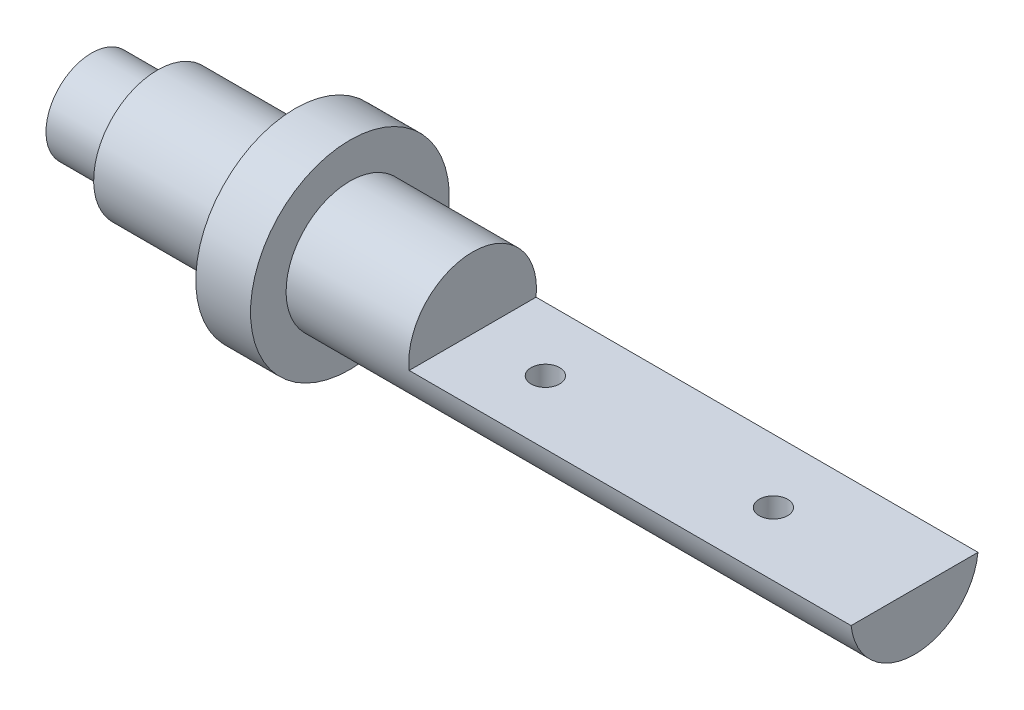
from build123d import *

# Parameters (mm, degrees)
CUT_EXTRUDE1_DEPTH      = 367.129389697
CUT_EXTRUDE1_DEPTH_BACK = 367.129389697
SKETCH2_W               = 193.8
SKETCH2_H               = 31.1
HOLE1_D                 = 12.5


with BuildPart() as part:
    # Sketch1 → Revolve1 (revolve)
    with BuildSketch(Plane.XY):
        Polygon((0, 0), (0, 20), (28.9, 20), (28.9, 28), (89.3, 28), (89.3, 43.6), (113.3, 43.6), (113.3, 28), (360.9, 28), (360.9, 0), align=None)
    revolve(axis=Axis((360.9, 0, 0), (-1, 0, 0)))

    # Sketch2 → Cut-Extrude1 (cut, two sides: drawn at the far end of the back side and taken through both)
    with BuildSketch(Plane.XY.offset(-CUT_EXTRUDE1_DEPTH_BACK)):
        with Locations((264, 12.45)):
            Rectangle(SKETCH2_W, SKETCH2_H)
    extrude(amount=CUT_EXTRUDE1_DEPTH + CUT_EXTRUDE1_DEPTH_BACK, mode=Mode.SUBTRACT)

    # Hole1 (through all)
    with Locations(Plane(origin=(0, -3.1, 0), x_dir=(1, 0, 0), z_dir=(0, 1, 0))):
        with Locations((199, 0), (299, 0)):
            Hole(HOLE1_D / 2)


solid = part.part
